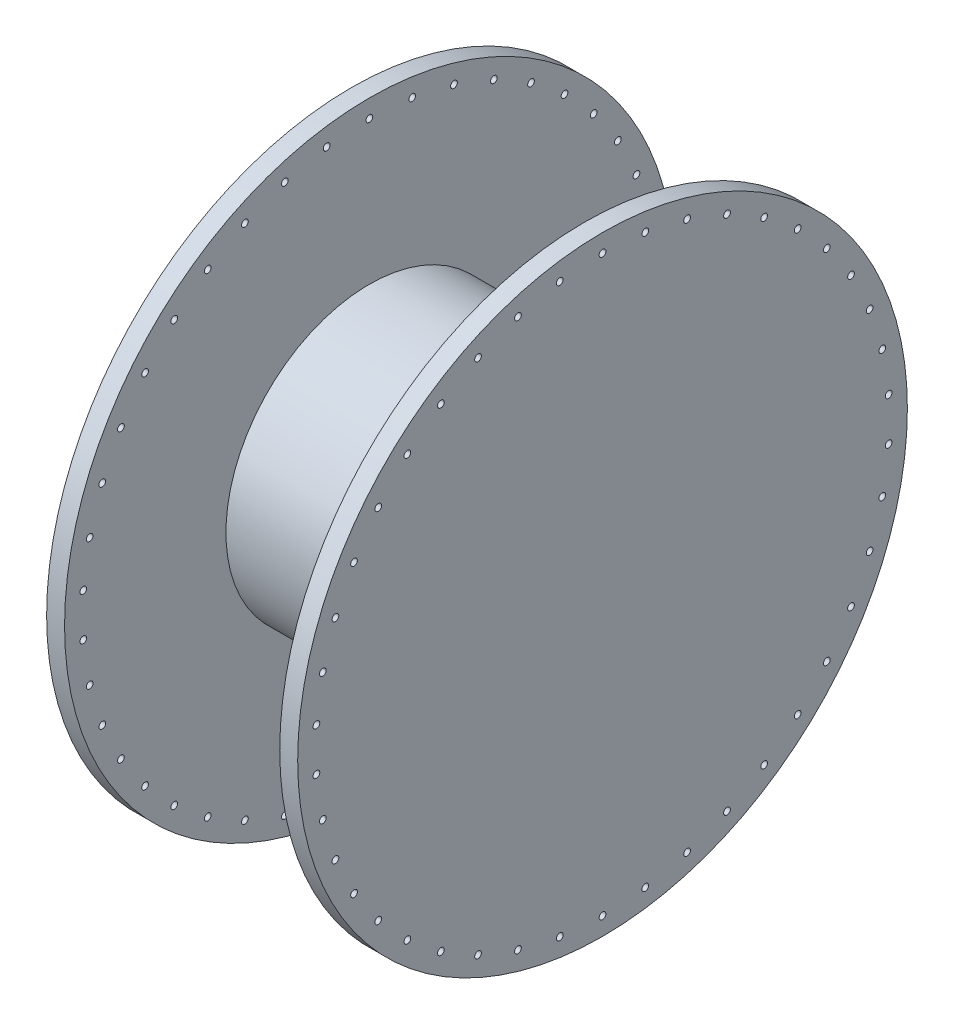
from build123d import *

# Parameters (mm, degrees)
SKETCH1_R           = 25.4
BOSS_EXTRUDE1_DEPTH = 22.225
BOSS_EXTRUDE2_START = 22.225
SKETCH1_3_R         = 53.975
SKETCH1_3_R_2       = 0.5953125
BOSS_EXTRUDE2_DEPTH = 3.175
BOSS_EXTRUDE3_START = -19.05
SKETCH1_4_R         = 53.975
SKETCH1_4_R_2       = 25.4
SKETCH1_4_R_3       = 0.5953125
BOSS_EXTRUDE3_DEPTH = 3.175


with BuildPart() as part:
    # Sketch1 → Boss-Extrude1 (new, symmetric)
    with BuildSketch(Plane(origin=(0, 0, 0), x_dir=(0, 0, -1), z_dir=(1, 0, 0))):
        Circle(SKETCH1_R)
    extrude(amount=BOSS_EXTRUDE1_DEPTH, both=True)

    # Sketch1<3> → Boss-Extrude2 (add)
    with BuildSketch(Plane(origin=(0, 0, 0), x_dir=(0, 0, -1), z_dir=(1, 0, 0)).offset(BOSS_EXTRUDE2_START)):
        Circle(SKETCH1_3_R)
        with Locations((0, 50.8)):
            Circle(SKETCH1_3_R_2, mode=Mode.SUBTRACT)
        with Locations((7.571347122, 50.232605972)):
            Circle(SKETCH1_3_R_2, mode=Mode.SUBTRACT)
        with Locations((14.97356286, 48.543098534)):
            Circle(SKETCH1_3_R_2, mode=Mode.SUBTRACT)
        with Locations((22.041293947, 45.769218489)):
            Circle(SKETCH1_3_R_2, mode=Mode.SUBTRACT)
        with Locations((28.61665895, 41.972929735)):
            Circle(SKETCH1_3_R_2, mode=Mode.SUBTRACT)
        with Locations((34.552775079, 37.239035089)):
            Circle(SKETCH1_3_R_2, mode=Mode.SUBTRACT)
        with Locations((39.717039309, 31.673281934)):
            Circle(SKETCH1_3_R_2, mode=Mode.SUBTRACT)
        with Locations((43.994090512, 25.4)):
            Circle(SKETCH1_3_R_2, mode=Mode.SUBTRACT)
        with Locations((47.288386431, 18.559324038)):
            Circle(SKETCH1_3_R_2, mode=Mode.SUBTRACT)
        with Locations((49.526337939, 11.304063445)):
            Circle(SKETCH1_3_R_2, mode=Mode.SUBTRACT)
        with Locations((50.657952897, 3.796288754)):
            Circle(SKETCH1_3_R_2, mode=Mode.SUBTRACT)
        with Locations((50.657952897, -3.796288754)):
            Circle(SKETCH1_3_R_2, mode=Mode.SUBTRACT)
        with Locations((49.526337939, -11.304063445)):
            Circle(SKETCH1_3_R_2, mode=Mode.SUBTRACT)
        with Locations((47.288386431, -18.559324038)):
            Circle(SKETCH1_3_R_2, mode=Mode.SUBTRACT)
        with Locations((43.994090512, -25.4)):
            Circle(SKETCH1_3_R_2, mode=Mode.SUBTRACT)
        with Locations((39.717039309, -31.673281934)):
            Circle(SKETCH1_3_R_2, mode=Mode.SUBTRACT)
        with Locations((34.552775079, -37.239035089)):
            Circle(SKETCH1_3_R_2, mode=Mode.SUBTRACT)
        with Locations((28.61665895, -41.972929735)):
            Circle(SKETCH1_3_R_2, mode=Mode.SUBTRACT)
        with Locations((22.041293947, -45.769218489)):
            Circle(SKETCH1_3_R_2, mode=Mode.SUBTRACT)
        with Locations((14.97356286, -48.543098534)):
            Circle(SKETCH1_3_R_2, mode=Mode.SUBTRACT)
        with Locations((7.571347122, -50.232605972)):
            Circle(SKETCH1_3_R_2, mode=Mode.SUBTRACT)
        with Locations((0, -50.8)):
            Circle(SKETCH1_3_R_2, mode=Mode.SUBTRACT)
        with Locations((-7.571347122, -50.232605972)):
            Circle(SKETCH1_3_R_2, mode=Mode.SUBTRACT)
        with Locations((-14.97356286, -48.543098534)):
            Circle(SKETCH1_3_R_2, mode=Mode.SUBTRACT)
        with Locations((-22.041293947, -45.769218489)):
            Circle(SKETCH1_3_R_2, mode=Mode.SUBTRACT)
        with Locations((-28.61665895, -41.972929735)):
            Circle(SKETCH1_3_R_2, mode=Mode.SUBTRACT)
        with Locations((-34.552775079, -37.239035089)):
            Circle(SKETCH1_3_R_2, mode=Mode.SUBTRACT)
        with Locations((-39.717039309, -31.673281934)):
            Circle(SKETCH1_3_R_2, mode=Mode.SUBTRACT)
        with Locations((-43.994090512, -25.4)):
            Circle(SKETCH1_3_R_2, mode=Mode.SUBTRACT)
        with Locations((-47.288386431, -18.559324038)):
            Circle(SKETCH1_3_R_2, mode=Mode.SUBTRACT)
        with Locations((-49.526337939, -11.304063445)):
            Circle(SKETCH1_3_R_2, mode=Mode.SUBTRACT)
        with Locations((-50.657952897, -3.796288754)):
            Circle(SKETCH1_3_R_2, mode=Mode.SUBTRACT)
        with Locations((-50.657952897, 3.796288754)):
            Circle(SKETCH1_3_R_2, mode=Mode.SUBTRACT)
        with Locations((-49.526337939, 11.304063445)):
            Circle(SKETCH1_3_R_2, mode=Mode.SUBTRACT)
        with Locations((-47.288386431, 18.559324038)):
            Circle(SKETCH1_3_R_2, mode=Mode.SUBTRACT)
        with Locations((-43.994090512, 25.4)):
            Circle(SKETCH1_3_R_2, mode=Mode.SUBTRACT)
        with Locations((-39.717039309, 31.673281934)):
            Circle(SKETCH1_3_R_2, mode=Mode.SUBTRACT)
        with Locations((-34.552775079, 37.239035089)):
            Circle(SKETCH1_3_R_2, mode=Mode.SUBTRACT)
        with Locations((-28.61665895, 41.972929735)):
            Circle(SKETCH1_3_R_2, mode=Mode.SUBTRACT)
        with Locations((-22.041293947, 45.769218489)):
            Circle(SKETCH1_3_R_2, mode=Mode.SUBTRACT)
        with Locations((-14.97356286, 48.543098534)):
            Circle(SKETCH1_3_R_2, mode=Mode.SUBTRACT)
        with Locations((-7.571347122, 50.232605972)):
            Circle(SKETCH1_3_R_2, mode=Mode.SUBTRACT)
    extrude(amount=-BOSS_EXTRUDE2_DEPTH)

    # Sketch1<4> → Boss-Extrude3 (add)
    with BuildSketch(Plane(origin=(0, 0, 0), x_dir=(0, 0, -1), z_dir=(1, 0, 0)).offset(BOSS_EXTRUDE3_START)):
        Circle(SKETCH1_4_R)
        Circle(SKETCH1_4_R_2, mode=Mode.SUBTRACT)
        with Locations((0, 50.8)):
            Circle(SKETCH1_4_R_3, mode=Mode.SUBTRACT)
        with Locations((7.571347122, 50.232605972)):
            Circle(SKETCH1_4_R_3, mode=Mode.SUBTRACT)
        with Locations((14.97356286, 48.543098534)):
            Circle(SKETCH1_4_R_3, mode=Mode.SUBTRACT)
        with Locations((22.041293947, 45.769218489)):
            Circle(SKETCH1_4_R_3, mode=Mode.SUBTRACT)
        with Locations((28.61665895, 41.972929735)):
            Circle(SKETCH1_4_R_3, mode=Mode.SUBTRACT)
        with Locations((34.552775079, 37.239035089)):
            Circle(SKETCH1_4_R_3, mode=Mode.SUBTRACT)
        with Locations((39.717039309, 31.673281934)):
            Circle(SKETCH1_4_R_3, mode=Mode.SUBTRACT)
        with Locations((43.994090512, 25.4)):
            Circle(SKETCH1_4_R_3, mode=Mode.SUBTRACT)
        with Locations((47.288386431, 18.559324038)):
            Circle(SKETCH1_4_R_3, mode=Mode.SUBTRACT)
        with Locations((49.526337939, 11.304063445)):
            Circle(SKETCH1_4_R_3, mode=Mode.SUBTRACT)
        with Locations((50.657952897, 3.796288754)):
            Circle(SKETCH1_4_R_3, mode=Mode.SUBTRACT)
        with Locations((50.657952897, -3.796288754)):
            Circle(SKETCH1_4_R_3, mode=Mode.SUBTRACT)
        with Locations((49.526337939, -11.304063445)):
            Circle(SKETCH1_4_R_3, mode=Mode.SUBTRACT)
        with Locations((47.288386431, -18.559324038)):
            Circle(SKETCH1_4_R_3, mode=Mode.SUBTRACT)
        with Locations((43.994090512, -25.4)):
            Circle(SKETCH1_4_R_3, mode=Mode.SUBTRACT)
        with Locations((39.717039309, -31.673281934)):
            Circle(SKETCH1_4_R_3, mode=Mode.SUBTRACT)
        with Locations((34.552775079, -37.239035089)):
            Circle(SKETCH1_4_R_3, mode=Mode.SUBTRACT)
        with Locations((28.61665895, -41.972929735)):
            Circle(SKETCH1_4_R_3, mode=Mode.SUBTRACT)
        with Locations((22.041293947, -45.769218489)):
            Circle(SKETCH1_4_R_3, mode=Mode.SUBTRACT)
        with Locations((14.97356286, -48.543098534)):
            Circle(SKETCH1_4_R_3, mode=Mode.SUBTRACT)
        with Locations((7.571347122, -50.232605972)):
            Circle(SKETCH1_4_R_3, mode=Mode.SUBTRACT)
        with Locations((0, -50.8)):
            Circle(SKETCH1_4_R_3, mode=Mode.SUBTRACT)
        with Locations((-7.571347122, -50.232605972)):
            Circle(SKETCH1_4_R_3, mode=Mode.SUBTRACT)
        with Locations((-14.97356286, -48.543098534)):
            Circle(SKETCH1_4_R_3, mode=Mode.SUBTRACT)
        with Locations((-22.041293947, -45.769218489)):
            Circle(SKETCH1_4_R_3, mode=Mode.SUBTRACT)
        with Locations((-28.61665895, -41.972929735)):
            Circle(SKETCH1_4_R_3, mode=Mode.SUBTRACT)
        with Locations((-34.552775079, -37.239035089)):
            Circle(SKETCH1_4_R_3, mode=Mode.SUBTRACT)
        with Locations((-39.717039309, -31.673281934)):
            Circle(SKETCH1_4_R_3, mode=Mode.SUBTRACT)
        with Locations((-43.994090512, -25.4)):
            Circle(SKETCH1_4_R_3, mode=Mode.SUBTRACT)
        with Locations((-47.288386431, -18.559324038)):
            Circle(SKETCH1_4_R_3, mode=Mode.SUBTRACT)
        with Locations((-49.526337939, -11.304063445)):
            Circle(SKETCH1_4_R_3, mode=Mode.SUBTRACT)
        with Locations((-50.657952897, -3.796288754)):
            Circle(SKETCH1_4_R_3, mode=Mode.SUBTRACT)
        with Locations((-50.657952897, 3.796288754)):
            Circle(SKETCH1_4_R_3, mode=Mode.SUBTRACT)
        with Locations((-49.526337939, 11.304063445)):
            Circle(SKETCH1_4_R_3, mode=Mode.SUBTRACT)
        with Locations((-47.288386431, 18.559324038)):
            Circle(SKETCH1_4_R_3, mode=Mode.SUBTRACT)
        with Locations((-43.994090512, 25.4)):
            Circle(SKETCH1_4_R_3, mode=Mode.SUBTRACT)
        with Locations((-39.717039309, 31.673281934)):
            Circle(SKETCH1_4_R_3, mode=Mode.SUBTRACT)
        with Locations((-34.552775079, 37.239035089)):
            Circle(SKETCH1_4_R_3, mode=Mode.SUBTRACT)
        with Locations((-28.61665895, 41.972929735)):
            Circle(SKETCH1_4_R_3, mode=Mode.SUBTRACT)
        with Locations((-22.041293947, 45.769218489)):
            Circle(SKETCH1_4_R_3, mode=Mode.SUBTRACT)
        with Locations((-14.97356286, 48.543098534)):
            Circle(SKETCH1_4_R_3, mode=Mode.SUBTRACT)
        with Locations((-7.571347122, 50.232605972)):
            Circle(SKETCH1_4_R_3, mode=Mode.SUBTRACT)
    extrude(amount=-BOSS_EXTRUDE3_DEPTH)


solid = part.part
